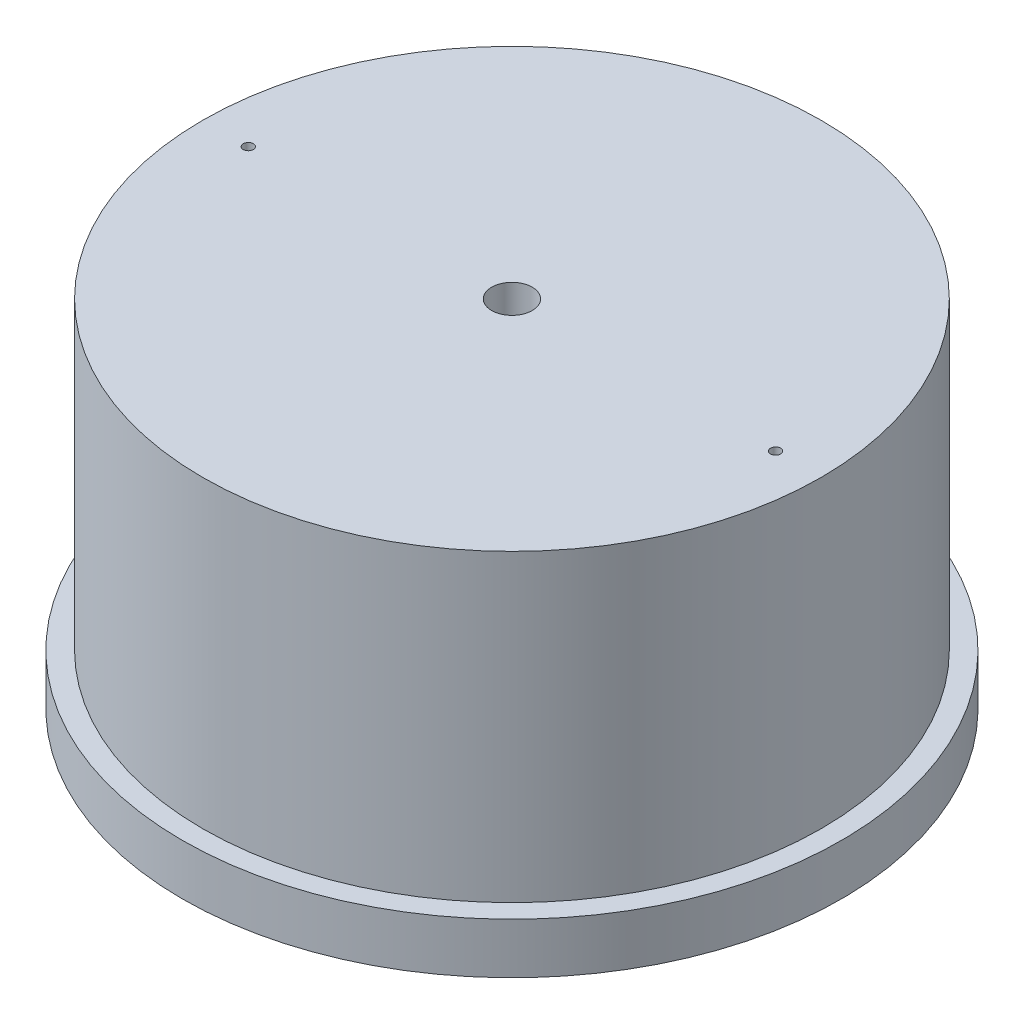
from build123d import *

# Parameters (mm, degrees)
SKETCH1_R           = 32.5
BOSS_EXTRUDE1_DEPTH = 35
CUT_EXTRUDE2_START  = -30
SKETCH2_R           = 32.5
SKETCH2_R_2         = 30.5
CUT_EXTRUDE2_DEPTH  = 30
SKETCH3_R           = 28
SKETCH3_R_2         = 24
CUT_EXTRUDE3_DEPTH  = 25
SKETCH4_R           = 18
CUT_EXTRUDE4_DEPTH  = 20
SKETCH5_R           = 0.5
CUT_EXTRUDE5_DEPTH  = 58.771100041
SKETCH6_R           = 2
CUT_EXTRUDE6_DEPTH  = 58.771100041


with BuildPart() as part:
    # Sketch1 → Boss-Extrude1 (new body)
    with BuildSketch(Plane(origin=(0, 0, 0), x_dir=(1, 0, 0), z_dir=(0, 1, 0))):
        with Locations(Location((0, 0, 0), (0, 0, 270))):
            Circle(SKETCH1_R)
    extrude(amount=BOSS_EXTRUDE1_DEPTH)

    # Sketch2 → Cut-Extrude2 (cut)
    with BuildSketch(Plane(origin=(0, 35, 0), x_dir=(1, 0, 0), z_dir=(0, 1, 0)).offset(CUT_EXTRUDE2_START)):
        with Locations(Location((0, 0, 0), (0, 0, 270))):
            Circle(SKETCH2_R)
        with Locations(Location((0, 0, 0), (0, 0, 270))):
            Circle(SKETCH2_R_2, mode=Mode.SUBTRACT)
    extrude(amount=CUT_EXTRUDE2_DEPTH, mode=Mode.SUBTRACT)

    # Sketch3 → Cut-Extrude3 (cut)
    with BuildSketch(Plane.XZ):
        with Locations(Location((0, 0, 0), (0, 0, 270))):
            Circle(SKETCH3_R)
        with Locations(Location((0, 0, 0), (0, 0, 270))):
            Circle(SKETCH3_R_2, mode=Mode.SUBTRACT)
    extrude(amount=-CUT_EXTRUDE3_DEPTH, mode=Mode.SUBTRACT)

    # Sketch4 → Cut-Extrude4 (cut)
    with BuildSketch(Plane.XZ):
        with Locations(Location((0, 0, 0), (0, 0, 270))):
            Circle(SKETCH4_R)
    extrude(amount=-CUT_EXTRUDE4_DEPTH, mode=Mode.SUBTRACT)

    # Sketch5 → Cut-Extrude5 (cut, through all)
    with BuildSketch(Plane(origin=(0, 35, 0), x_dir=(1, 0, 0), z_dir=(0, 1, 0))):
        with Locations(Location((-26, 0, 0), (0, 0, 270))):
            Circle(SKETCH5_R)
        with Locations(Location((26, 0, 0), (0, 0, 270))):
            Circle(SKETCH5_R)
    extrude(amount=-CUT_EXTRUDE5_DEPTH, mode=Mode.SUBTRACT)

    # Sketch6 → Cut-Extrude6 (cut, through all)
    with BuildSketch(Plane(origin=(0, 35, 0), x_dir=(1, 0, 0), z_dir=(0, 1, 0))):
        with Locations(Location((0, 0, 0), (0, 0, 270))):
            Circle(SKETCH6_R)
    extrude(amount=-CUT_EXTRUDE6_DEPTH, mode=Mode.SUBTRACT)


solid = part.part
